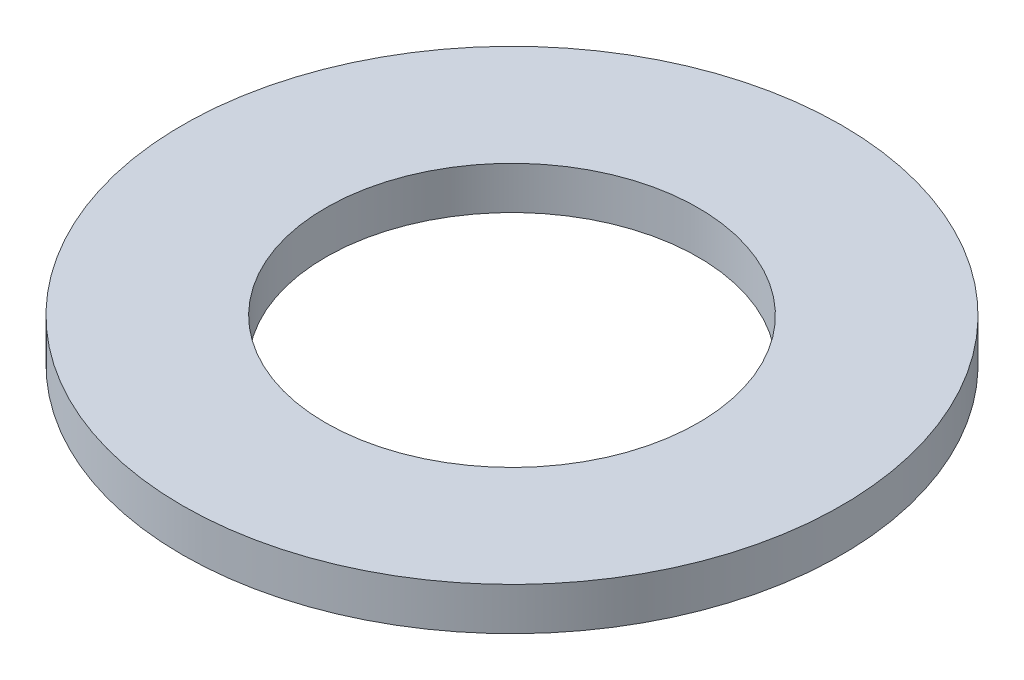
from build123d import *

# Parameters (mm, degrees)
SKETCH2_R           = 23.176923077
SKETCH2_R_2         = 13.1
BOSS_EXTRUDE1_DEPTH = 3


with BuildPart() as part:
    # Sketch2 → Boss-Extrude1 (new body)
    with BuildSketch(Plane(origin=(0, 0, 0), x_dir=(1, 0, 0), z_dir=(0, 1, 0))):
        with Locations(Location((0, 0, 0), (0, 0, 270))):
            Circle(SKETCH2_R)
        with Locations(Location((0, 0, 0), (0, 0, 270))):
            Circle(SKETCH2_R_2, mode=Mode.SUBTRACT)
    extrude(amount=BOSS_EXTRUDE1_DEPTH)


solid = part.part
